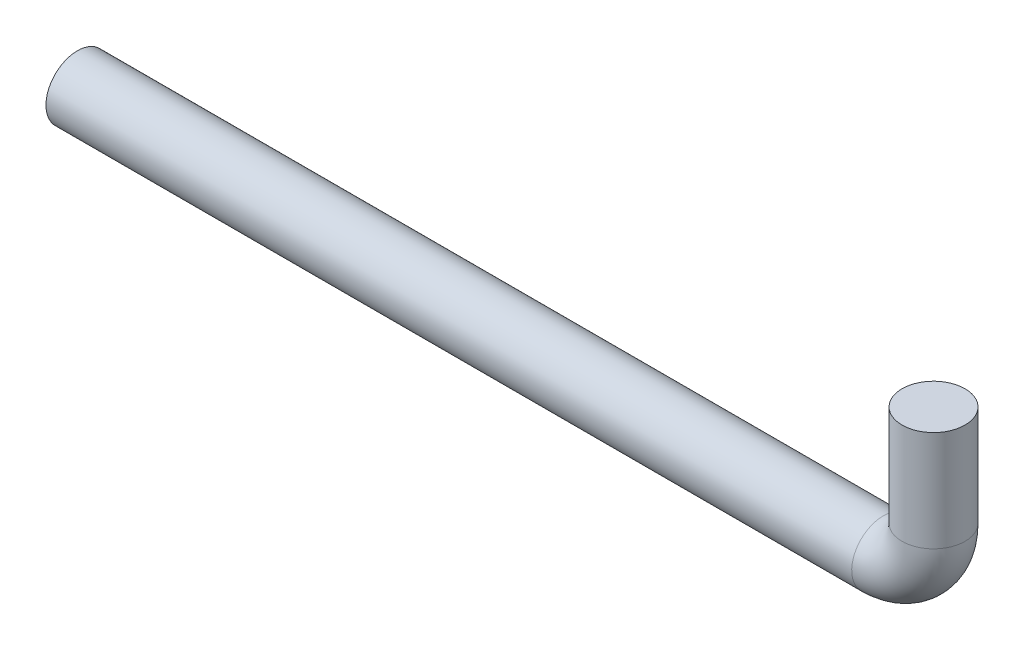
from build123d import *

# Parameters (mm, degrees)
SKETCH1_R = 0.79375


with BuildPart() as part:
    # Sweep1: sweep along a path in Sketch2
    with BuildLine(Plane.XY) as sweep1_path:
        Line((0, 0), (20.32, 0))
        ThreePointArc((20.32, 0), (21.218025612, 0.371974388), (21.59, 1.27))
        Line((21.59, 1.27), (21.59, 3.81))
    # Sketch1 → Sweep1 (sweep)
    with BuildSketch(Plane(origin=(0, 0, 0), x_dir=(0, 0, -1), z_dir=(1, 0, 0))):
        Circle(SKETCH1_R)
    sweep(path=sweep1_path.line)


solid = part.part
